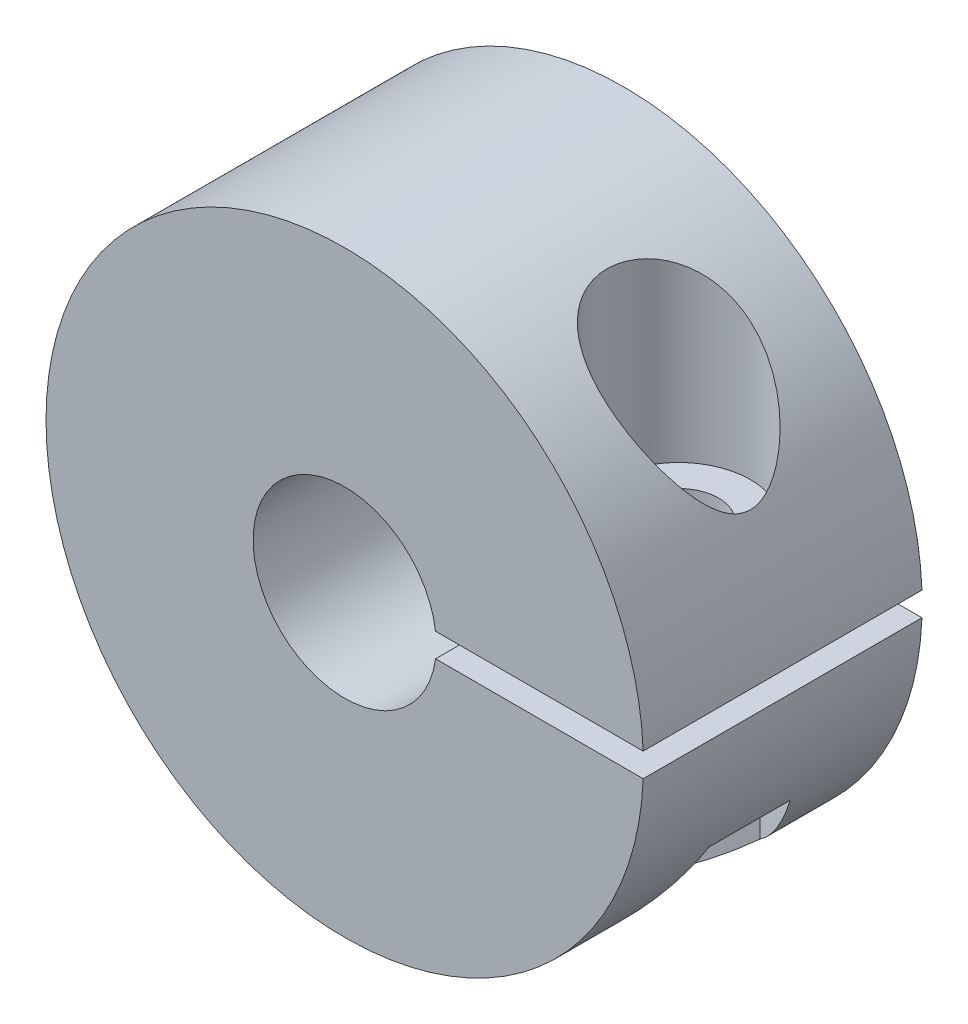
from build123d import *

# Parameters (mm, degrees)
SKETCH1_R               = 15
SKETCH1_R_2             = 4.6
BOSS_EXTRUDE1_DEPTH     = 14
SKETCH2_W               = 12.4
SKETCH2_H               = 1.2
CUT_EXTRUDE1_DEPTH      = 26.416530054
CUT_EXTRUDE2_DEPTH      = 26.416530054
CUT_EXTRUDE2_DEPTH_BACK = 26.416530054
SKETCH3_R               = 2
CUT_EXTRUDE3_REACH      = 30.306
CUT_EXTRUDE3_END_RADIUS = 15
SKETCH4_R               = 3.6
CUT_EXTRUDE4_REACH      = 30.306
CUT_EXTRUDE4_END_RADIUS = 15


with BuildPart() as part:
    # Sketch1 → Boss-Extrude1 (new body)
    with BuildSketch(Plane.XY):
        Circle(SKETCH1_R)
        Circle(SKETCH1_R_2, mode=Mode.SUBTRACT)
    extrude(amount=BOSS_EXTRUDE1_DEPTH)

    # Sketch2 → Cut-Extrude1 (cut, through all)
    with BuildSketch(Plane.XY.offset(14)):
        with Locations((9.8, 0)):
            Rectangle(SKETCH2_W, SKETCH2_H)
    extrude(amount=-CUT_EXTRUDE1_DEPTH, mode=Mode.SUBTRACT)

    # Sketch3 → Cut-Extrude2 (cut, two sides: drawn at the far end of the back side and taken through both)
    with BuildSketch(Plane(origin=(0, 0, 0), x_dir=(1, 0, 0), z_dir=(0, 1, 0)).offset(-CUT_EXTRUDE2_DEPTH_BACK)):
        with Locations(Location((9.774348448, -7, 0), (0, 0, 270))):
            Circle(SKETCH3_R)
    extrude(amount=CUT_EXTRUDE2_DEPTH + CUT_EXTRUDE2_DEPTH_BACK, mode=Mode.SUBTRACT)

    # Cut-Extrude3: up to this cylinder (the profile starts inside it)
    cut_extrude3_end = Plane(origin=(0, 0, 7), z_dir=(0, 0, -1)) * Cylinder(CUT_EXTRUDE3_END_RADIUS, 91.612, mode=Mode.PRIVATE)
    # Sketch4 → Cut-Extrude3 (cut, up to the surface)
    with BuildSketch(Plane(origin=(0, 4.5, 0), x_dir=(1, 0, 0), z_dir=(0, 1, 0)), mode=Mode.PRIVATE) as cut_extrude3_sk1:
        with Locations(Location((9.774348448, -7, 0), (0, 0, 90))):
            Circle(SKETCH4_R)
    cut_extrude3_tool1 = extrude(cut_extrude3_sk1.sketch, amount=CUT_EXTRUDE3_REACH, mode=Mode.PRIVATE) & cut_extrude3_end
    add(cut_extrude3_tool1.solids().sort_by_distance((9.774348, 4.5, 7))[0], mode=Mode.SUBTRACT)

    # Cut-Extrude4: up to this cylinder (the profile starts inside it)
    cut_extrude4_end = Plane(origin=(0, 0, 7), z_dir=(0, 0, -1)) * Cylinder(CUT_EXTRUDE4_END_RADIUS, 91.612, mode=Mode.PRIVATE)
    # Sketch5 → Cut-Extrude4 (cut, up to the surface)
    with BuildSketch(Plane(origin=(0, -4.5, 0), x_dir=(1, 0, 0), z_dir=(0, 1, 0)), mode=Mode.PRIVATE) as cut_extrude4_sk1:
        Polygon((6.229720914, -9.058870802), (9.785069099, -11.099172892), (13.329696633, -9.04030209), (13.318975982, -4.941129198), (9.763627798, -2.900827108), (6.219000264, -4.95969791), align=None)
    cut_extrude4_tool1 = extrude(cut_extrude4_sk1.sketch, amount=-CUT_EXTRUDE4_REACH, mode=Mode.PRIVATE) & cut_extrude4_end
    add(cut_extrude4_tool1.solids().sort_by_distance((9.774348, -4.5, 7))[0], mode=Mode.SUBTRACT)


solid = part.part
